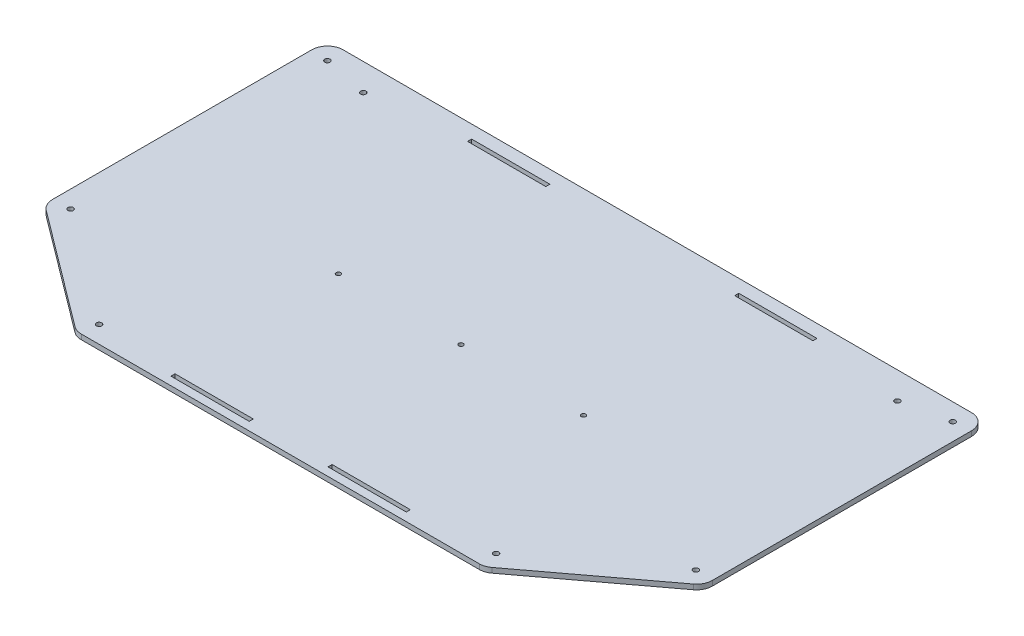
from build123d import *

# Parameters (mm, degrees)
BOSS_EXTRUDE1_DEPTH = 3.175
FILLET1_R           = 10
SKETCH2_R           = 1.7
SKETCH2_R_2         = 1.45
CUT_EXTRUDE1_DEPTH  = 3.175
SKETCH6_W           = 49.8
SKETCH6_H           = 2.6
CUT_EXTRUDE2_DEPTH  = 3.175


with BuildPart() as part:
    # Sketch1 → Boss-Extrude1 (new body)
    with BuildSketch(Plane(origin=(0, 0, 0), x_dir=(1, 0, 0), z_dir=(0, 1, 0))):
        Polygon((0, 240), (0, 60), (80, 0), (340, 0), (420, 60), (420, 240), align=None)
    extrude(amount=BOSS_EXTRUDE1_DEPTH)

    # Fillet1
    fillet1_edges = [part.edges().sort_by_distance(p)[0] for p in [
        (420, 1.5875, -240),
        (420, 1.5875, -60),
        (340, 1.5875, 0),
        (80, 1.5875, 0),
        (0, 1.5875, -60),
        (0, 1.5875, -240),
    ]]
    fillet(fillet1_edges, radius=FILLET1_R)

    # Sketch2 → Cut-Extrude1 (cut)
    with BuildSketch(Plane(origin=(0, 3.175, 0), x_dir=(1, 0, 0), z_dir=(0, 1, 0))):
        with Locations(Location((11, 229, 0), (0, 0, 270))):
            Circle(SKETCH2_R)
        with Locations(Location((11, 65.5, 0), (0, 0, 270))):
            Circle(SKETCH2_R)
        with Locations(Location((83.666666667, 11, 0), (0, 0, 270))):
            Circle(SKETCH2_R)
        with Locations(Location((409, 65.5, 0), (0, 0, 270))):
            Circle(SKETCH2_R)
        with Locations(Location((336.333333333, 11, 0), (0, 0, 270))):
            Circle(SKETCH2_R)
        with Locations(Location((210, 115, 0), (0, 0, 270))):
            Circle(SKETCH2_R_2)
        with Locations(Location((132, 115, 0), (0, 0, 270))):
            Circle(SKETCH2_R_2)
        with Locations(Location((288, 115, 0), (0, 0, 270))):
            Circle(SKETCH2_R_2)
        with Locations(Location((40, 222.825, 0), (0, 0, 270))):
            Circle(SKETCH2_R)
        with Locations(Location((380, 222.825, 0), (0, 0, 270))):
            Circle(SKETCH2_R)
        with Locations(Location((409, 229, 0), (0, 0, 270))):
            Circle(SKETCH2_R)
    extrude(amount=-CUT_EXTRUDE1_DEPTH, mode=Mode.SUBTRACT)

    # Sketch6 → Cut-Extrude2 (cut)
    with BuildSketch(Plane(origin=(0, 3.175, 0), x_dir=(1, 0, 0), z_dir=(0, 1, 0))):
        with Locations((160, 6.5875)):
            Rectangle(SKETCH6_W, SKETCH6_H)
        with Locations((125, 230.4125)):
            Rectangle(SKETCH6_W, SKETCH6_H)
        with Locations((295, 230.4125)):
            Rectangle(SKETCH6_W, SKETCH6_H)
        with Locations((260, 6.5875)):
            Rectangle(SKETCH6_W, SKETCH6_H)
    extrude(amount=-CUT_EXTRUDE2_DEPTH, mode=Mode.SUBTRACT)


solid = part.part
